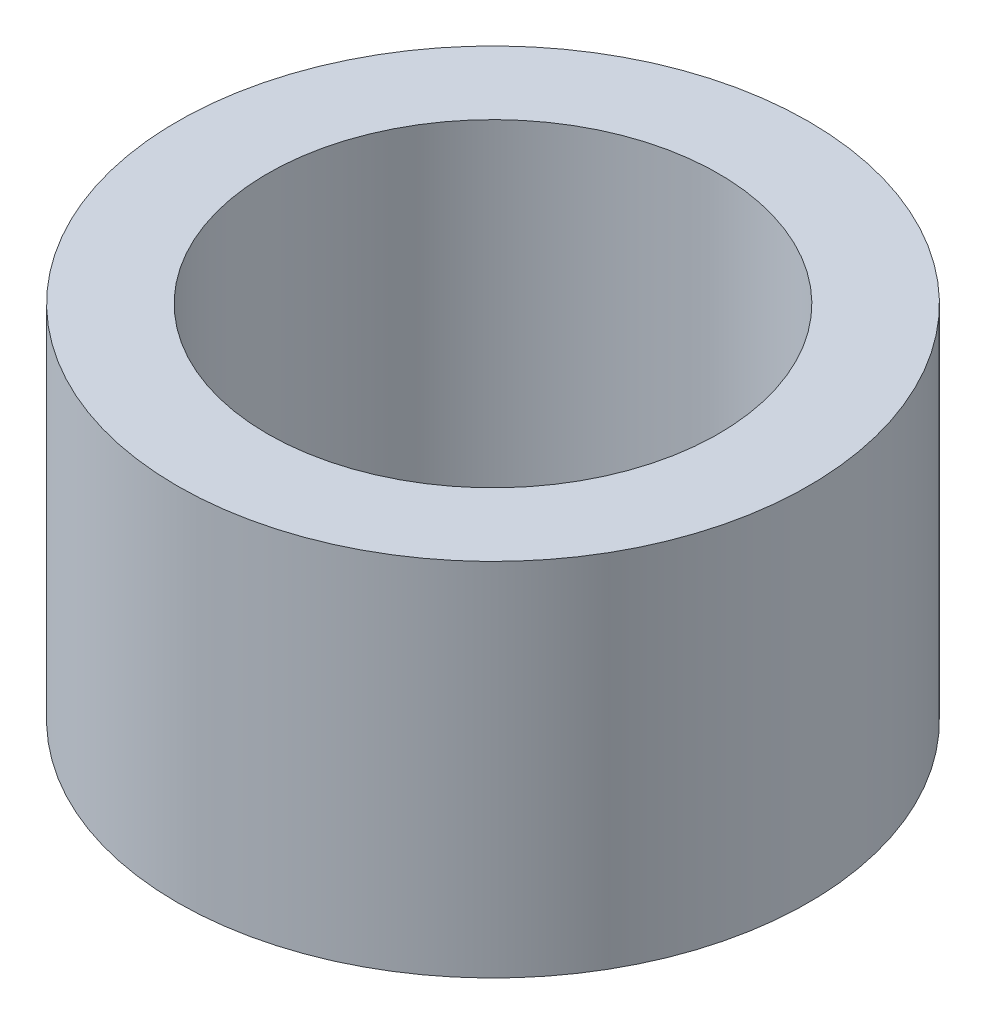
from build123d import *

# Parameters (mm, degrees)
SCHIZZO1_R                   = 7
SCHIZZO1_R_2                 = 5
ESTRUSIONE_ESTRUSIONE1_DEPTH = 8


with BuildPart() as part:
    # Schizzo1 → Estrusione-Estrusione1 (new body)
    with BuildSketch(Plane(origin=(0, 0, 0), x_dir=(1, 0, 0), z_dir=(0, 1, 0))):
        with Locations(Location((0, 0, 0), (0, 0, 270))):
            Circle(SCHIZZO1_R)
        with Locations(Location((0, 0, 0), (0, 0, 270))):
            Circle(SCHIZZO1_R_2, mode=Mode.SUBTRACT)
    extrude(amount=ESTRUSIONE_ESTRUSIONE1_DEPTH)


solid = part.part
